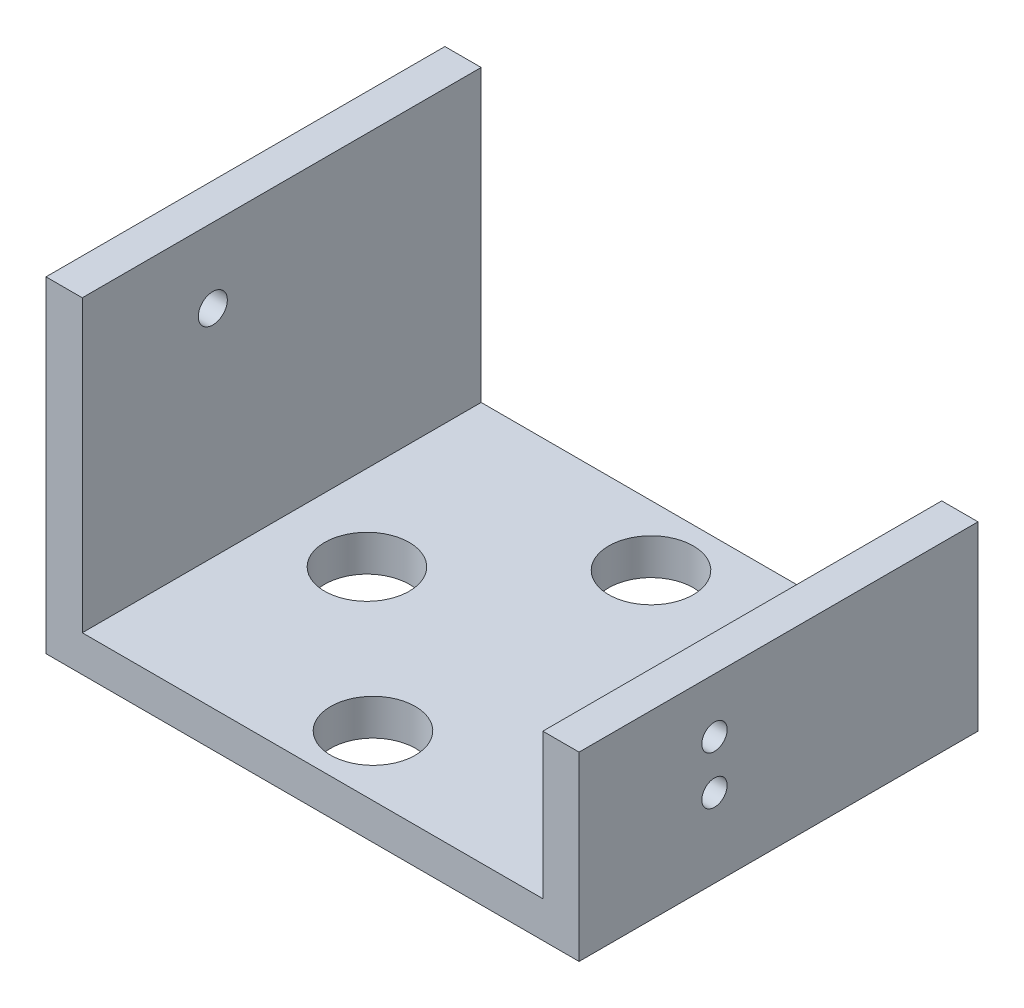
from build123d import *

# Parameters (mm, degrees)
SKIZZE1_W                       = 44.1
SKIZZE1_H                       = 33
AUFSATZ_LINEAR_AUSTRAGEN1_DEPTH = 3
SKIZZE2_W                       = 3
SKIZZE2_H                       = 33
AUFSATZ_LINEAR_AUSTRAGEN2_DEPTH = 24
SKIZZE3_W                       = 33
SKIZZE3_H                       = 12
SCHNITT_LINEAR_AUSTRAGEN1_DEPTH = 24
SKIZZE4_R                       = 1.2
SCHNITT_LINEAR_AUSTRAGEN2_DEPTH = 10
SKIZZE5_R                       = 1.05
SCHNITT_LINEAR_AUSTRAGEN3_DEPTH = 10
SKIZZE6_R                       = 3.5
SCHNITT_LINEAR_AUSTRAGEN4_DEPTH = 10


with BuildPart() as part:
    # Skizze1 → Aufsatz-Linear austragen1 (new body)
    with BuildSketch(Plane(origin=(0, 0, 0), x_dir=(1, 0, 0), z_dir=(0, 1, 0))):
        Rectangle(SKIZZE1_W, SKIZZE1_H)
    extrude(amount=AUFSATZ_LINEAR_AUSTRAGEN1_DEPTH)

    # Skizze2 → Aufsatz-Linear austragen2 (add)
    with BuildSketch(Plane(origin=(0, 3, 0), x_dir=(1, 0, 0), z_dir=(0, 1, 0))):
        with Locations((-20.55, 0)):
            Rectangle(SKIZZE2_W, SKIZZE2_H)
        with Locations((20.55, 0)):
            Rectangle(SKIZZE2_W, SKIZZE2_H)
    extrude(amount=AUFSATZ_LINEAR_AUSTRAGEN2_DEPTH)

    # Skizze3 → Schnitt-Linear austragen1 (cut)
    with BuildSketch(Plane(origin=(22.05, 0, 0), x_dir=(0, 0, -1), z_dir=(1, 0, 0))):
        with Locations((0, 21)):
            Rectangle(SKIZZE3_W, SKIZZE3_H)
    extrude(amount=-SCHNITT_LINEAR_AUSTRAGEN1_DEPTH, mode=Mode.SUBTRACT)

    # Skizze4 → Schnitt-Linear austragen2 (cut)
    with BuildSketch(Plane(origin=(-19.05, 0, 0), x_dir=(0, 0, -1), z_dir=(1, 0, 0))):
        with Locations((-5.7, 20.85)):
            Circle(SKIZZE4_R)
    extrude(amount=-SCHNITT_LINEAR_AUSTRAGEN2_DEPTH, mode=Mode.SUBTRACT)

    # Skizze5 → Schnitt-Linear austragen3 (cut)
    with BuildSketch(Plane(origin=(22.05, 0, 0), x_dir=(0, 0, -1), z_dir=(1, 0, 0))):
        with Locations((-5.3, 10.5)):
            Circle(SKIZZE5_R)
        with Locations((-5.3, 6.5)):
            Circle(SKIZZE5_R)
    extrude(amount=-SCHNITT_LINEAR_AUSTRAGEN3_DEPTH, mode=Mode.SUBTRACT)

    # Skizze6 → Schnitt-Linear austragen4 (cut)
    with BuildSketch(Plane.XZ):
        with Locations(Location((-12, 0, 0), (0, 0, 270))):
            Circle(SKIZZE6_R)
        with Locations(Location((0, -11.5, 0), (0, 0, 270))):
            Circle(SKIZZE6_R)
        with Locations(Location((12, 0, 0), (0, 0, 270))):
            Circle(SKIZZE6_R)
        with Locations(Location((0, 11.5, 0), (0, 0, 270))):
            Circle(SKIZZE6_R)
    extrude(amount=-SCHNITT_LINEAR_AUSTRAGEN4_DEPTH, mode=Mode.SUBTRACT)


solid = part.part
